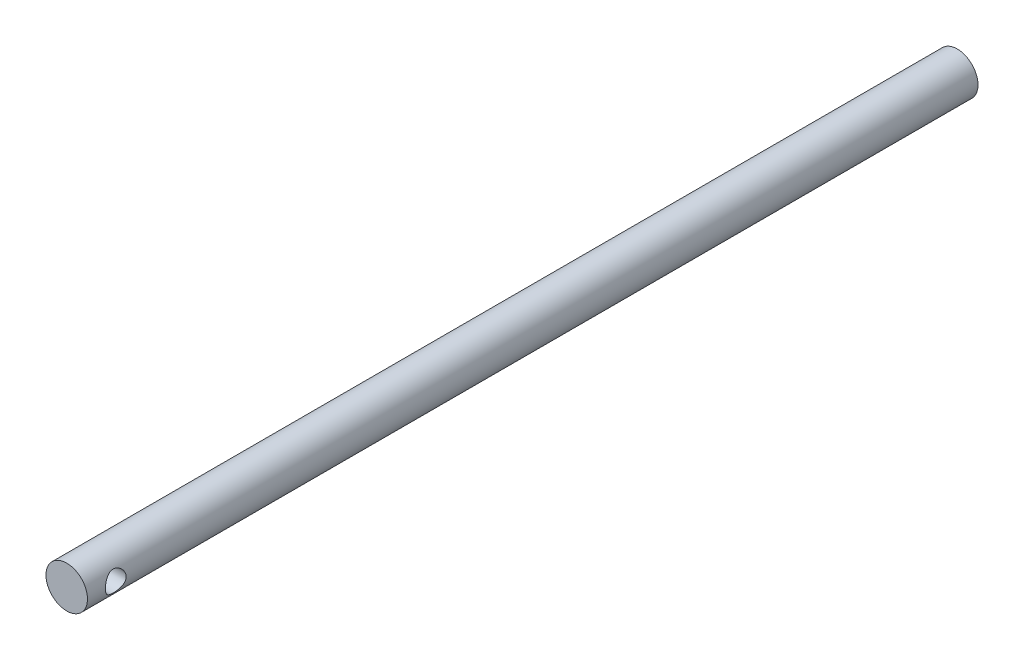
from build123d import *

# Parameters (mm, degrees)
SKETCH1_R               = 4.763
BOSS_EXTRUDE1_DEPTH     = 204.364
CUT_EXTRUDE1_DEPTH      = 205.474978503
CUT_EXTRUDE1_DEPTH_BACK = 205.474978503
SKETCH2_R               = 2.3815


with BuildPart() as part:
    # Sketch1 → Boss-Extrude1 (new body)
    with BuildSketch(Plane.XY):
        Circle(SKETCH1_R)
    extrude(amount=BOSS_EXTRUDE1_DEPTH)

    # Sketch2 → Cut-Extrude1 (cut, two sides: drawn at the far end of the back side and taken through both)
    with BuildSketch(Plane(origin=(0, 0, 0), x_dir=(0, 0, -1), z_dir=(1, 0, 0)).offset(-CUT_EXTRUDE1_DEPTH_BACK)):
        with Locations((-197.864, 0)):
            Circle(SKETCH2_R)
    extrude(amount=CUT_EXTRUDE1_DEPTH + CUT_EXTRUDE1_DEPTH_BACK, mode=Mode.SUBTRACT)


solid = part.part
